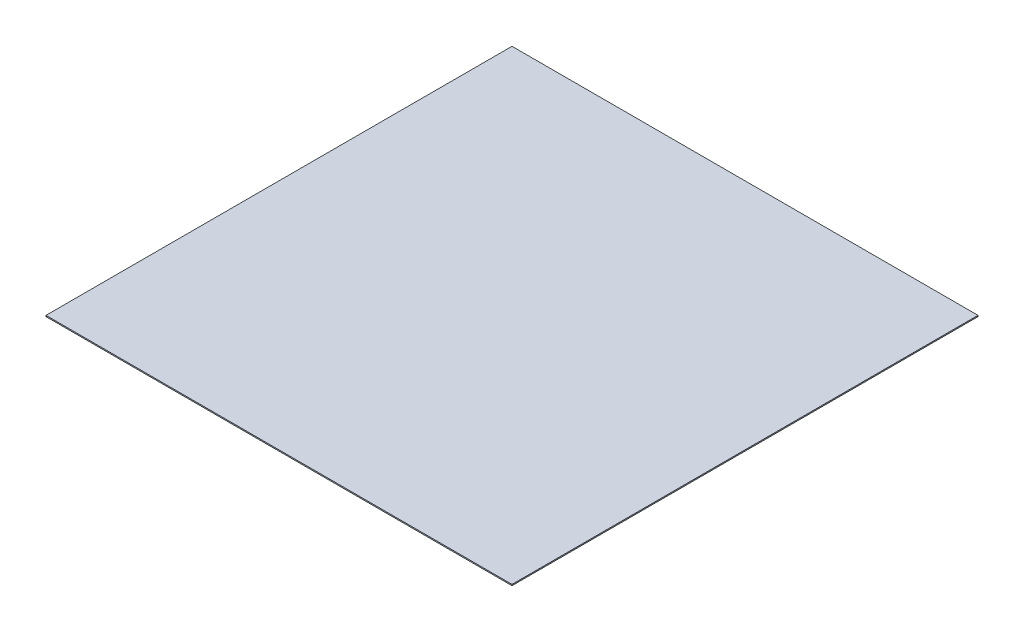
from build123d import *

# Parameters (mm, degrees)
SKETCH1_W           = 400
SKETCH1_H           = 400
BOSS_EXTRUDE1_DEPTH = 1


with BuildPart() as part:
    # Sketch1 → Boss-Extrude1 (new body)
    with BuildSketch(Plane(origin=(0, 0, 0), x_dir=(1, 0, 0), z_dir=(0, 1, 0))):
        Rectangle(SKETCH1_W, SKETCH1_H)
    extrude(amount=BOSS_EXTRUDE1_DEPTH)


solid = part.part
